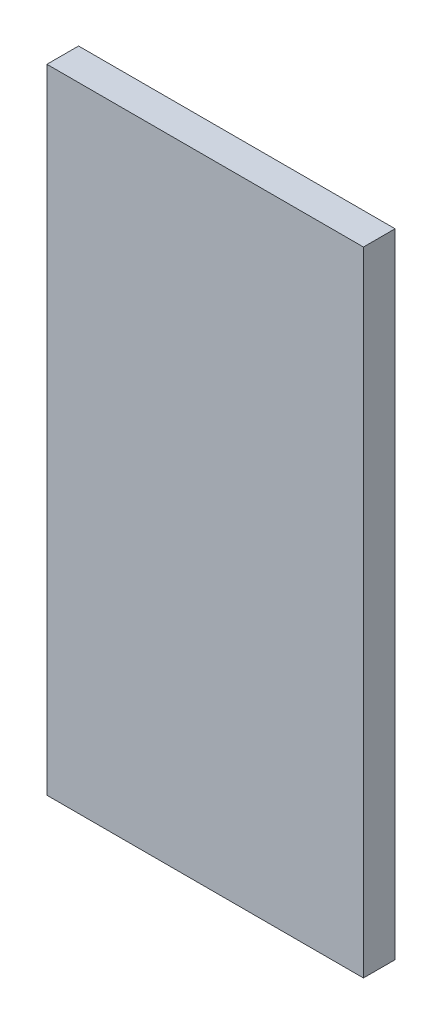
from build123d import *

# Parameters (mm, degrees)
SKETCH2_W           = 1000
SKETCH2_H           = 2000
BOSS_EXTRUDE2_DEPTH = 100


with BuildPart() as part:
    # Sketch2 → Boss-Extrude2 (new body)
    with BuildSketch(Plane.XY):
        with Locations((500, 1000)):
            Rectangle(SKETCH2_W, SKETCH2_H)
    extrude(amount=BOSS_EXTRUDE2_DEPTH)


solid = part.part
